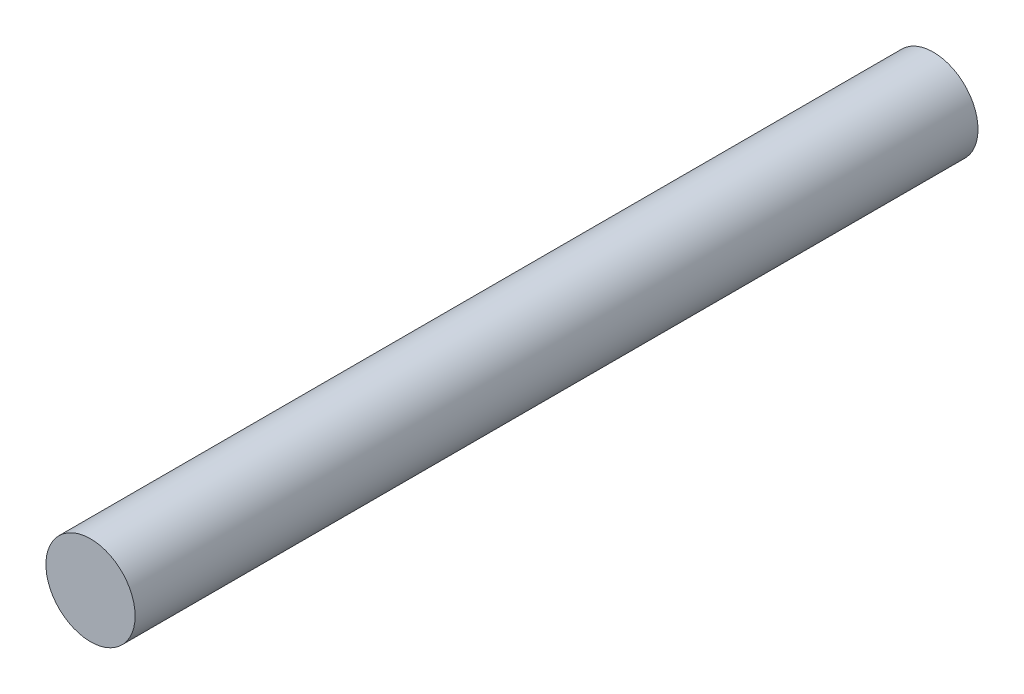
from build123d import *

# Parameters (mm, degrees)
CROQUIS1_R              = 7.9375
SALIENTE_EXTRUIR1_DEPTH = 75


with BuildPart() as part:
    # Croquis1 → Saliente-Extruir1 (new, symmetric)
    with BuildSketch(Plane.XY):
        Circle(CROQUIS1_R)
    extrude(amount=SALIENTE_EXTRUIR1_DEPTH, both=True)


solid = part.part
